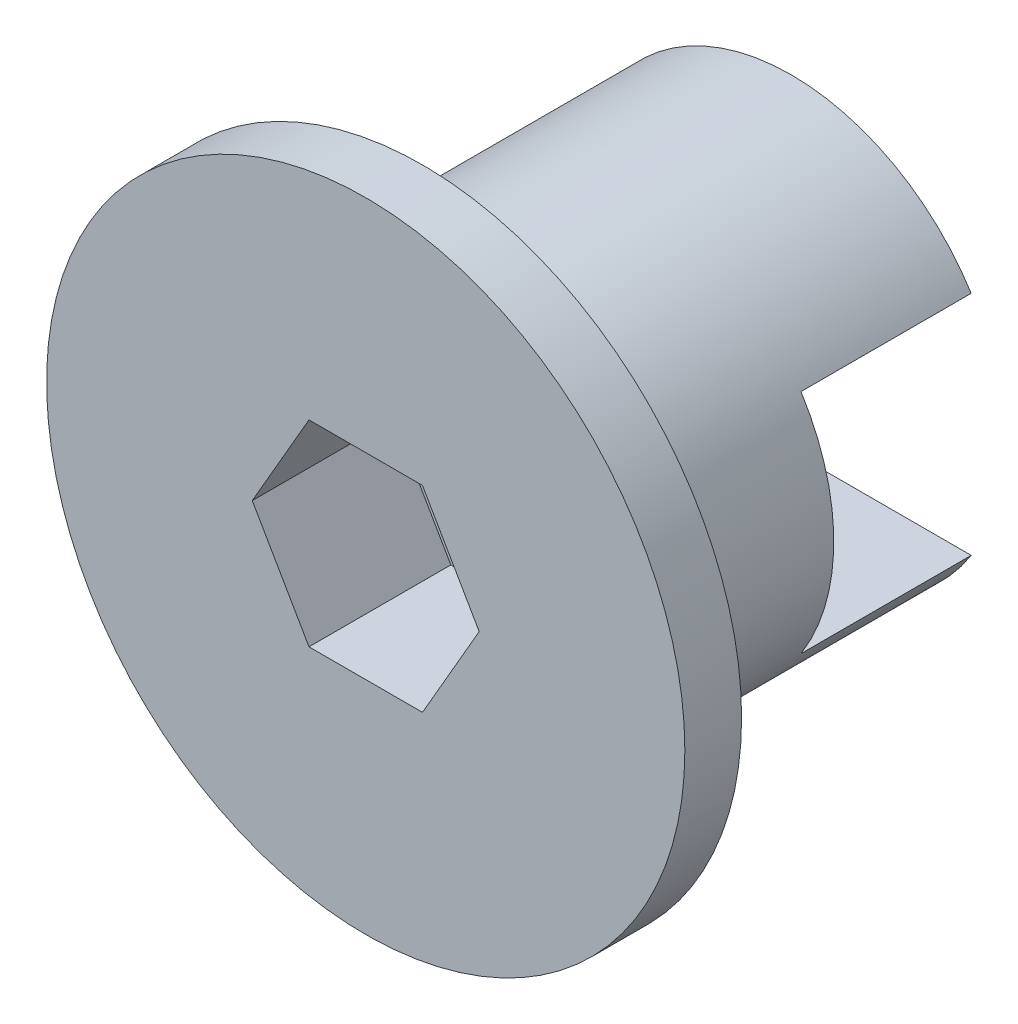
from build123d import *

# Parameters (mm, degrees)
SKETCH1_R               = 15
SKETCH1_R_2             = 5
BOSS_EXTRUDE1_DEPTH     = 30
CUT_EXTRUDE1_DEPTH      = 10
CUT_EXTRUDE2_DEPTH      = 37.742346142
CUT_EXTRUDE2_DEPTH_BACK = 37.742346142
SKETCH3_W               = 12
SKETCH3_H               = 16
BOSS_EXTRUDE2_START     = -4
SKETCH4_R               = 22.5
SKETCH4_R_2             = 15
BOSS_EXTRUDE2_DEPTH     = 4


with BuildPart() as part:
    # Sketch1 → Boss-Extrude1 (new body)
    with BuildSketch(Plane.XY):
        Circle(SKETCH1_R)
        Circle(SKETCH1_R_2, mode=Mode.SUBTRACT)
    extrude(amount=BOSS_EXTRUDE1_DEPTH)

    # Sketch2 → Cut-Extrude1 (cut)
    with BuildSketch(Plane.XY.offset(30)):
        Polygon((8, 0), (4, 6.92820323), (-4, 6.92820323), (-8, 0), (-4, -6.92820323), (4, -6.92820323), align=None)
    extrude(amount=-CUT_EXTRUDE1_DEPTH, mode=Mode.SUBTRACT)

    # Sketch3 → Cut-Extrude2 (cut, two sides: drawn at the far end of the back side and taken through both)
    with BuildSketch(Plane(origin=(0, 0, 0), x_dir=(0, 0, -1), z_dir=(1, 0, 0)).offset(-CUT_EXTRUDE2_DEPTH_BACK)):
        with Locations((-6, 0)):
            Rectangle(SKETCH3_W, SKETCH3_H)
    extrude(amount=CUT_EXTRUDE2_DEPTH + CUT_EXTRUDE2_DEPTH_BACK, mode=Mode.SUBTRACT)

    # Sketch4 → Boss-Extrude2 (add)
    with BuildSketch(Plane.XY.offset(30).offset(BOSS_EXTRUDE2_START)):
        Circle(SKETCH4_R)
        with Locations(Location((0, 0, 0), (0, 0, 147.769047364))):
            Circle(SKETCH4_R_2, mode=Mode.SUBTRACT)
    extrude(amount=BOSS_EXTRUDE2_DEPTH)


solid = part.part
